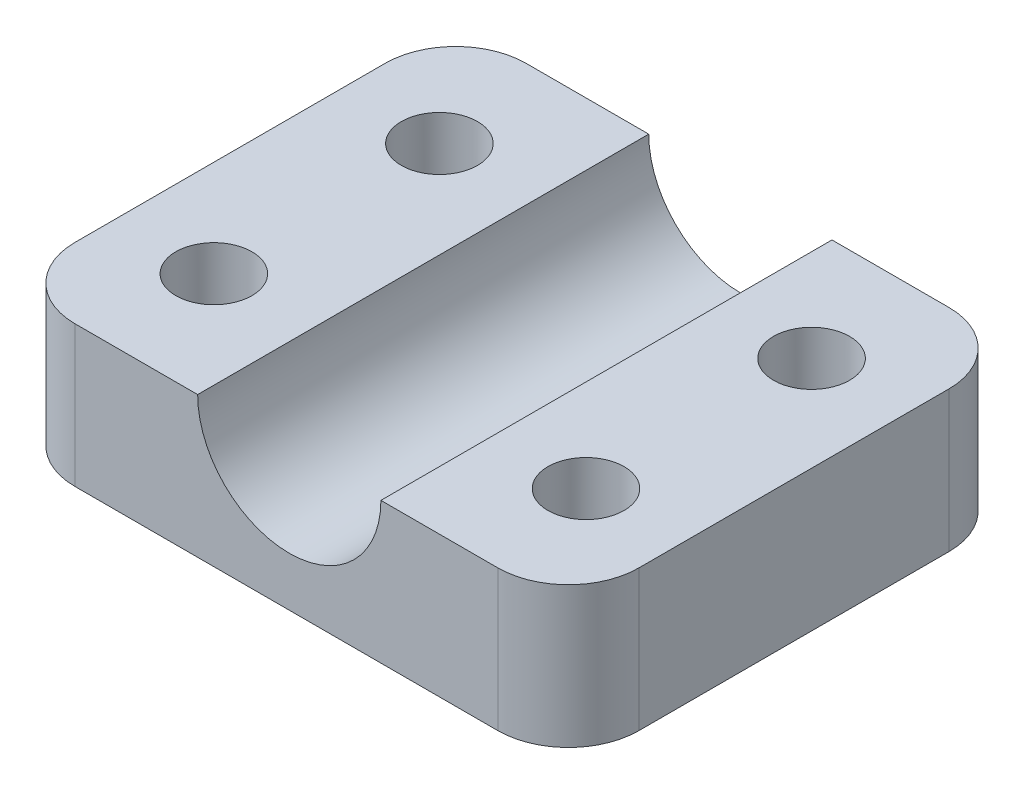
from build123d import *

# Parameters (mm, degrees)
SKETCH1_W               = 50.8
SKETCH1_H               = 40.64
BOSS_EXTRUDE1_DEPTH     = 12.7
CUT_EXTRUDE1_DEPTH      = 67.283780822
CUT_EXTRUDE1_DEPTH_BACK = 67.283780822
CUT_EXTRUDE2_DEPTH      = 67.283780822
CUT_EXTRUDE2_DEPTH_BACK = 67.283780822
SKETCH3_R               = 3.429
FILLET1_R               = 6.35


with BuildPart() as part:
    # Sketch1 → Boss-Extrude1 (new body)
    with BuildSketch(Plane(origin=(0, 0, 0), x_dir=(1, 0, 0), z_dir=(0, 1, 0))):
        with Locations((25.4, 20.32)):
            Rectangle(SKETCH1_W, SKETCH1_H)
    extrude(amount=BOSS_EXTRUDE1_DEPTH)

    # Sketch2 → Cut-Extrude1 (cut, two sides: drawn at the far end of the back side and taken through both)
    with BuildSketch(Plane.XY.offset(-CUT_EXTRUDE1_DEPTH_BACK)):
        with BuildLine():
            Line((33.909, 12.7), (25.4, 12.7))
            Line((25.4, 12.7), (25.4, 4.448908618))
            ThreePointArc((25.4, 4.448908618), (31.400662292, 6.773711322), (33.909, 12.7))
        make_face()
        with BuildLine():
            Line((25.4, 4.448908618), (25.4, 12.7))
            Line((25.4, 12.7), (17.399, 12.7))
            ThreePointArc((17.399, 12.7), (19.727711322, 6.953337708), (25.4, 4.448908618))
        make_face()
        with BuildLine():
            Line((33.909, 12.7), (25.4, 12.7))
            Line((25.4, 12.7), (25.4, 4.448908618))
            ThreePointArc((25.4, 4.448908618), (31.400662292, 6.773711322), (33.909, 12.7))
        make_face()
        with BuildLine():
            Line((25.4, 4.448908618), (25.4, 12.7))
            Line((25.4, 12.7), (17.399, 12.7))
            ThreePointArc((17.399, 12.7), (19.727711322, 6.953337708), (25.4, 4.448908618))
        make_face()
    extrude(amount=CUT_EXTRUDE1_DEPTH + CUT_EXTRUDE1_DEPTH_BACK, mode=Mode.SUBTRACT)

    # Sketch3 → Cut-Extrude2 (cut, two sides: drawn at the far end of the back side and taken through both)
    with BuildSketch(Plane(origin=(0, 12.7, 0), x_dir=(1, 0, 0), z_dir=(0, 1, 0)).offset(-CUT_EXTRUDE2_DEPTH_BACK)):
        with Locations(Location((8.6995, 10.16, 0), (0, 0, 270))):
            Circle(SKETCH3_R)
        with Locations(Location((42.2275, 10.16, 0), (0, 0, 270))):
            Circle(SKETCH3_R)
        with Locations(Location((42.2275, 30.48, 0), (0, 0, 270))):
            Circle(SKETCH3_R)
        with Locations(Location((8.6995, 30.48, 0), (0, 0, 270))):
            Circle(SKETCH3_R)
    extrude(amount=CUT_EXTRUDE2_DEPTH + CUT_EXTRUDE2_DEPTH_BACK, mode=Mode.SUBTRACT)

    # Fillet1
    fillet1_edges = [part.edges().sort_by_distance(p)[0] for p in [
        (0, 6.35, -40.64),
        (50.8, 6.35, -40.64),
        (50.8, 6.35, 0),
        (0, 6.35, 0),
    ]]
    fillet(fillet1_edges, radius=FILLET1_R)


solid = part.part
